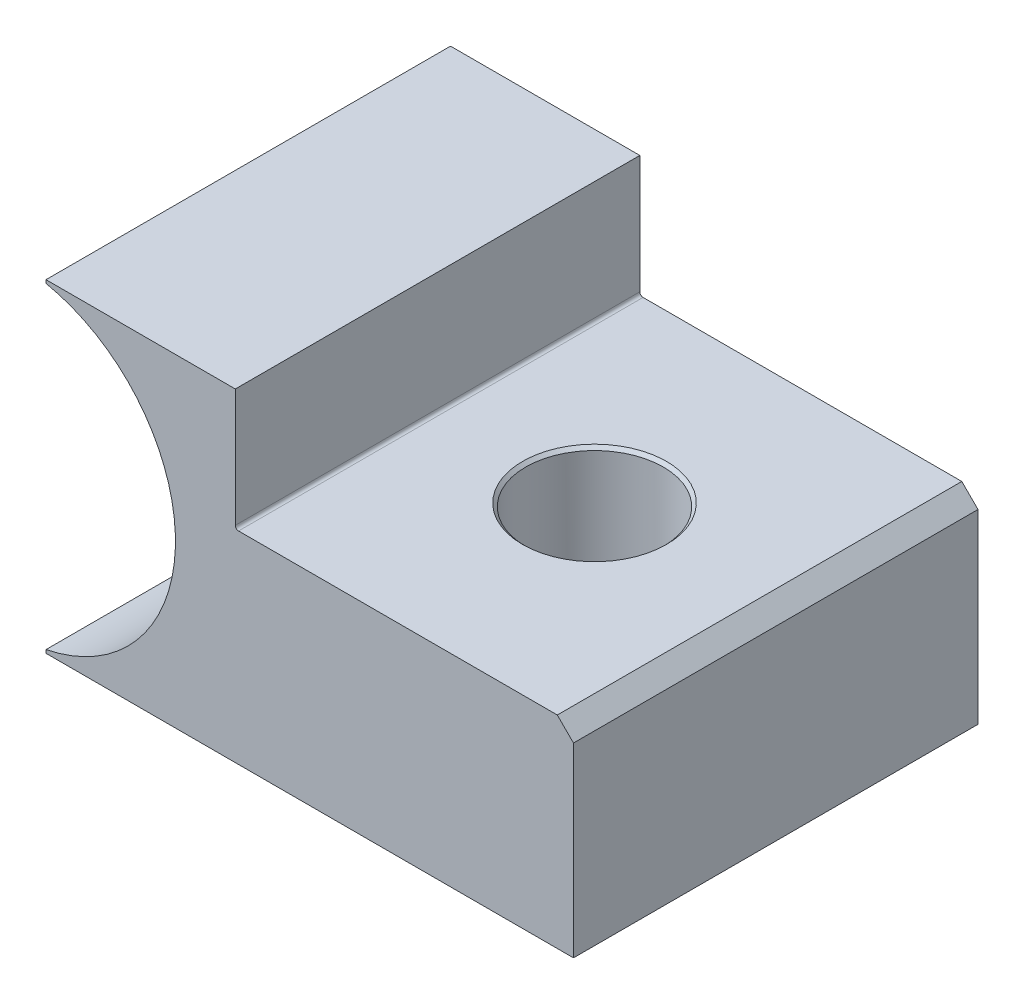
from build123d import *

# Parameters (mm, degrees)
BOSS_EXTRUDE1_DEPTH      = 31.75
X_0_397_DIAMETER_HOLE1_D = 10.795
CHAMFER1_SIZE            = 1.27
CHAMFER2_SIZE            = 0.254
FILLET1_R                = 0.254


with BuildPart() as part:
    # Sketch1 → Boss-Extrude1 (new body)
    with BuildSketch(Plane.XY):
        with BuildLine():
            Line((2.54, 0), (43.942, 0))
            Line((43.942, 0), (43.942, 15.875))
            Line((43.942, 15.875), (17.399, 15.875))
            Line((17.399, 15.875), (17.399, 25.4))
            Line((17.399, 25.4), (2.54, 25.4))
            Line((2.54, 25.4), (2.54, 25.143407893))
            ThreePointArc((2.54, 25.143407893), (12.7, 12.7), (2.54, 0.256592107))
            Line((2.54, 0.256592107), (2.54, 0))
        make_face()
    extrude(amount=BOSS_EXTRUDE1_DEPTH)

    # X (0.397) Diameter Hole1 (through all)
    with Locations(Plane(origin=(0, 15.875, 0), x_dir=(1, 0, 0), z_dir=(0, 1, 0))):
        with Locations((29.718, -15.875)):
            Hole(X_0_397_DIAMETER_HOLE1_D / 2)

    # Chamfer1
    chamfer1_edges = [part.edges().sort_by_distance(p)[0] for p in [
        (43.942, 15.875, 15.875),
    ]]
    chamfer(chamfer1_edges, length=CHAMFER1_SIZE)

    # Chamfer2
    chamfer2_edges = [part.edges().sort_by_distance(p)[0] for p in [
        (35.1155, 15.875, 15.875),
    ]]
    chamfer(chamfer2_edges, length=CHAMFER2_SIZE)

    # Fillet1
    fillet1_edges = [part.edges().sort_by_distance(p)[0] for p in [
        (17.399, 15.875, 15.875),
    ]]
    fillet(fillet1_edges, radius=FILLET1_R)


solid = part.part
